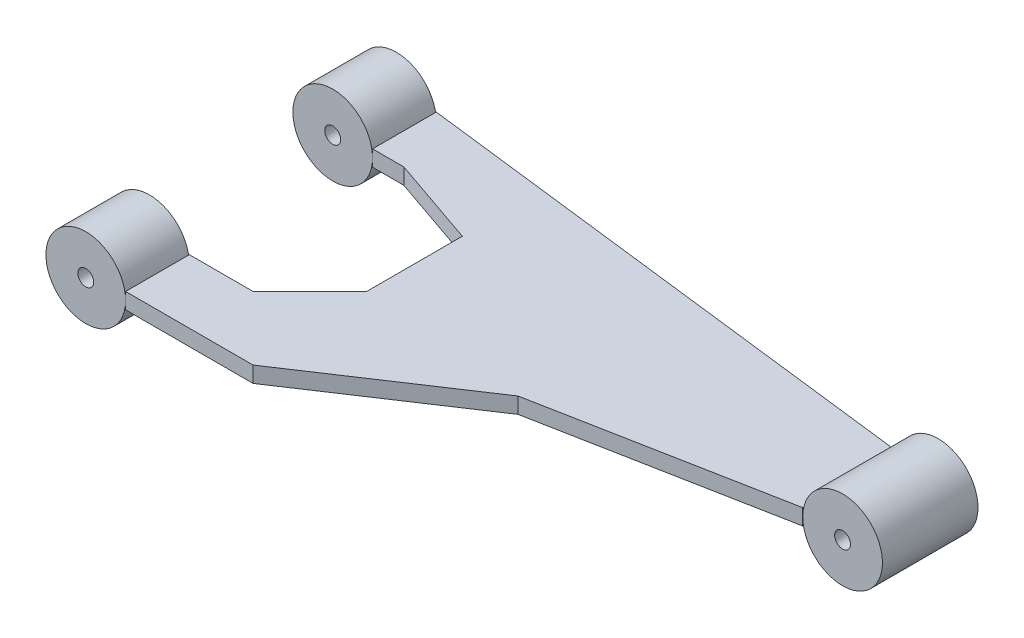
from build123d import *

# Parameters (mm, degrees)
SKETCH1_R               = 15.875
SKETCH1_R_2             = 3.175
BOSS_EXTRUDE1_DEPTH     = 123.825
BOSS_EXTRUDE1_2_DEPTH   = 123.825
BOSS_EXTRUDE2_DEPTH     = 3.175
CUT_EXTRUDE1_DEPTH      = 286.873445558
CUT_EXTRUDE1_DEPTH_BACK = 286.873445558
SKETCH3_W               = 31.75
SKETCH3_H               = 73.025
SKETCH3_H_2             = 25.4
SKETCH3_H_3             = 60.325


with BuildPart() as part:
    # Sketch1 → Boss-Extrude1 (new body)
    with BuildSketch(Plane.XY):
        Circle(SKETCH1_R)
        Circle(SKETCH1_R_2, mode=Mode.SUBTRACT)
    extrude(amount=BOSS_EXTRUDE1_DEPTH)


with BuildPart() as body_2:
    # Sketch1 → Boss-Extrude1 2 (new body)
    with BuildSketch(Plane.XY):
        with Locations((241.3, 0)):
            Circle(SKETCH1_R)
        with Locations((241.3, 0)):
            Circle(SKETCH1_R_2, mode=Mode.SUBTRACT)
    extrude(amount=BOSS_EXTRUDE1_2_DEPTH)


with BuildPart() as body_3:
    # Sketch2 → Boss-Extrude2 (new, symmetric)
    with BuildSketch(Plane(origin=(0, 0, 0), x_dir=(1, 0, 0), z_dir=(0, 1, 0))):
        Polygon((15.875, 0), (225.425, -25.4), (225.425, -63.5), (130.175, -81.703865162), (66.675, -123.825), (15.875, -123.825), (15.875, -98.425), (41.275, -98.425), (63.921723228, -75.778276772), (63.921723228, -37.678276772), (28.355179528, -25.4), (15.875, -25.4), align=None)
    extrude(amount=BOSS_EXTRUDE2_DEPTH, both=True)


with BuildPart() as cut_extrude1_tool:
    # Sketch3 → Cut-Extrude1 (new, two sides: drawn at the far end of the back side and taken through both)
    with BuildSketch(Plane(origin=(0, 0, 0), x_dir=(1, 0, 0), z_dir=(0, 1, 0)).offset(-CUT_EXTRUDE1_DEPTH_BACK)):
        with Locations((0, -61.9125)):
            Rectangle(SKETCH3_W, SKETCH3_H)
        with Locations((241.3, -12.7)):
            Rectangle(SKETCH3_W, SKETCH3_H_2)
        with Locations((241.3, -93.6625)):
            Rectangle(SKETCH3_W, SKETCH3_H_3)
    extrude(amount=CUT_EXTRUDE1_DEPTH + CUT_EXTRUDE1_DEPTH_BACK)


with BuildPart() as part_1:
    add(part.part)

    # Cut-Extrude1: cut by cut_extrude1_tool
    add(cut_extrude1_tool.part, mode=Mode.SUBTRACT)


with BuildPart() as body_2_1:
    add(body_2.part)

    # Cut-Extrude1: cut by cut_extrude1_tool
    add(cut_extrude1_tool.part, mode=Mode.SUBTRACT)


solid = Compound([body_3.part, part_1.part, body_2_1.part])
